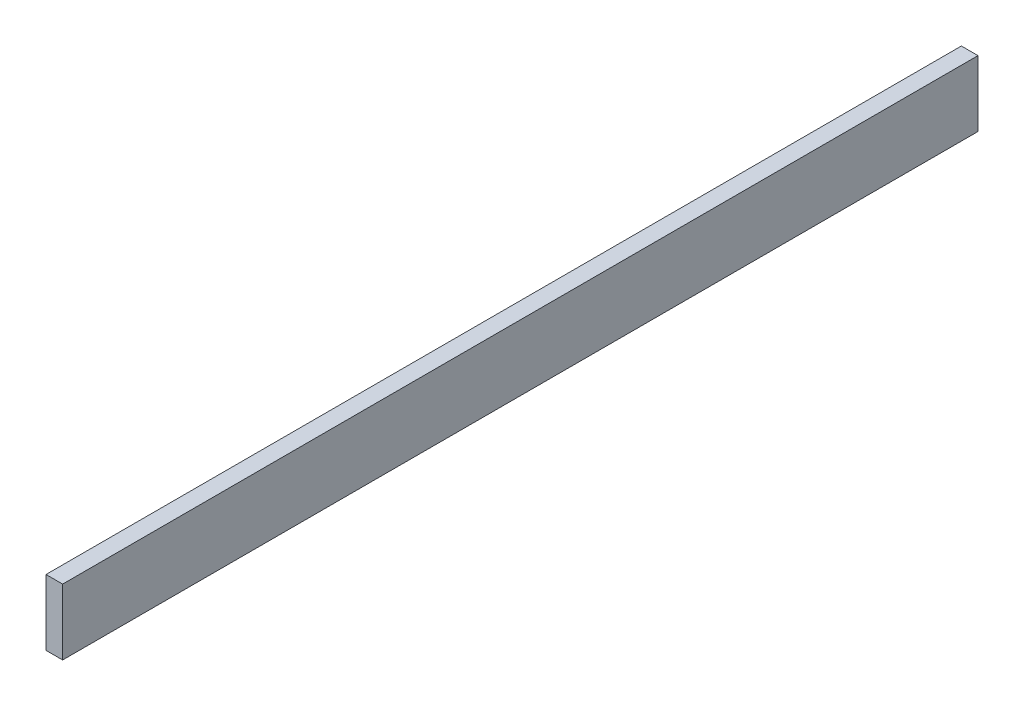
from build123d import *

# Parameters (mm, degrees)
SKETCH1_W           = 12.7
SKETCH1_H           = 45.212
BOSS_EXTRUDE1_DEPTH = 558.8
SKETCH2_OUTSIDE_W   = 126.854
SKETCH2_OUTSIDE_H   = 159.366
SKETCH2_OUTSIDE_W_2 = 10.16
SKETCH2_OUTSIDE_H_2 = 40.132
CUT_EXTRUDE1_DEPTH  = 560.293119693


with BuildPart() as part:
    # Sketch1 → Boss-Extrude1 (new body)
    with BuildSketch(Plane.XY):
        Rectangle(SKETCH1_W, SKETCH1_H)
    extrude(amount=BOSS_EXTRUDE1_DEPTH)

    # Sketch2 outside → Cut-Extrude1 (cut, through all)
    with BuildSketch(Plane.XY.offset(558.8)):
        Rectangle(SKETCH2_OUTSIDE_W, SKETCH2_OUTSIDE_H)
        with Locations((-1.27, 0)):
            Rectangle(SKETCH2_OUTSIDE_W_2, SKETCH2_OUTSIDE_H_2, mode=Mode.SUBTRACT)
    extrude(amount=-CUT_EXTRUDE1_DEPTH, mode=Mode.SUBTRACT)


solid = part.part
